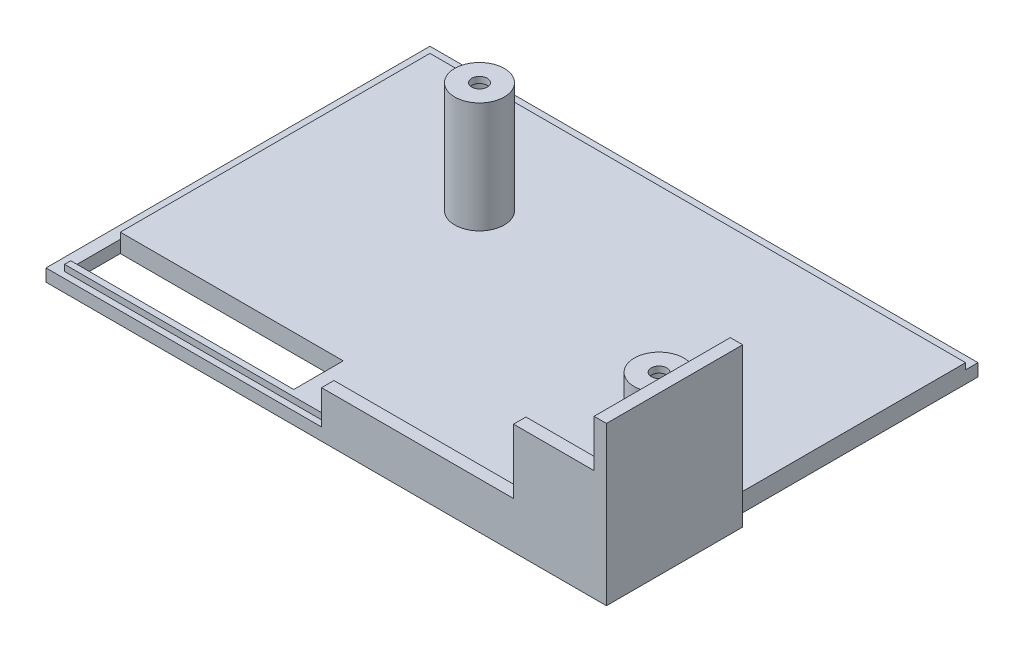
from build123d import *

# Parameters (mm, degrees)
SKETCH1_W           = 90.5
SKETCH1_H           = 62
BOSS_EXTRUDE2_DEPTH = 2
SKETCH5_W           = 88.5
SKETCH5_H           = 59
BOSS_EXTRUDE4_DEPTH = 1
SKETCH6_W           = 46
SKETCH6_H           = 2
BOSS_EXTRUDE5_DEPTH = 5.5
SKETCH7_W           = 15
SKETCH7_H           = 2
BOSS_EXTRUDE6_DEPTH = 10.4
SKETCH8_W           = 2
SKETCH8_H           = 22
BOSS_EXTRUDE7_DEPTH = 22.5
SKETCH9_W           = 36
SKETCH9_H           = 8
CUT_EXTRUDE3_DEPTH  = 15.9
SKETCH10_R          = 4
BOSS_EXTRUDE9_DEPTH = 17.9
SKETCH14_R          = 3
CUT_EXTRUDE7_DEPTH  = 19.9
SKETCH15_R          = 1.25
CUT_EXTRUDE8_DEPTH  = 113.625485571
SKETCH17_W          = 2
SKETCH17_H          = 40
CUT_EXTRUDE9_DEPTH  = 112.98437391


with BuildPart() as part:
    # Sketch1 → Boss-Extrude2 (new body)
    with BuildSketch(Plane(origin=(0, 0, 0), x_dir=(1, 0, 0), z_dir=(0, 1, 0))):
        with Locations((45.25, 31)):
            Rectangle(SKETCH1_W, SKETCH1_H)
    extrude(amount=BOSS_EXTRUDE2_DEPTH)

    # Sketch5 → Boss-Extrude4 (add)
    with BuildSketch(Plane(origin=(0, 2, 0), x_dir=(1, 0, 0), z_dir=(0, 1, 0))):
        with Locations((46.25, 30.5)):
            Rectangle(SKETCH5_W, SKETCH5_H)
    extrude(amount=BOSS_EXTRUDE4_DEPTH)

    # Sketch6 → Boss-Extrude5 (add)
    with BuildSketch(Plane(origin=(0, 2, 0), x_dir=(1, 0, 0), z_dir=(0, 1, 0))):
        with Locations((67.5, 1)):
            Rectangle(SKETCH6_W, SKETCH6_H)
    extrude(amount=BOSS_EXTRUDE5_DEPTH)

    # Sketch7 → Boss-Extrude6 (add)
    with BuildSketch(Plane(origin=(0, 7.5, 0), x_dir=(1, 0, 0), z_dir=(0, 1, 0))):
        with Locations((83, 1)):
            Rectangle(SKETCH7_W, SKETCH7_H)
    extrude(amount=BOSS_EXTRUDE6_DEPTH)

    # Sketch8 → Boss-Extrude7 (add)
    with BuildSketch(Plane(origin=(0, 3, 0), x_dir=(1, 0, 0), z_dir=(0, 1, 0))):
        with Locations((89.5, 11)):
            Rectangle(SKETCH8_W, SKETCH8_H)
    extrude(amount=BOSS_EXTRUDE7_DEPTH)

    # Sketch9 → Cut-Extrude3 (cut)
    with BuildSketch(Plane(origin=(0, 3, 0), x_dir=(1, 0, 0), z_dir=(0, 1, 0))):
        with Locations((20, 6)):
            Rectangle(SKETCH9_W, SKETCH9_H)
    extrude(amount=-CUT_EXTRUDE3_DEPTH, mode=Mode.SUBTRACT)

    # Sketch10 → Boss-Extrude9 (add)
    with BuildSketch(Plane(origin=(0, 3, 0), x_dir=(1, 0, 0), z_dir=(0, 1, 0))):
        with Locations(Location((28, 42, 0), (0, 0, 90))):
            Circle(SKETCH10_R)
        with Locations(Location((83, 16, 0), (0, 0, 90))):
            Circle(SKETCH10_R)
    extrude(amount=BOSS_EXTRUDE9_DEPTH)

    # Sketch14 → Cut-Extrude7 (cut)
    with BuildSketch(Plane.XZ):
        with Locations(Location((28, -42, 0), (0, 0, 270))):
            Circle(SKETCH14_R)
        with Locations(Location((83, -16, 0), (0, 0, 270))):
            Circle(SKETCH14_R)
    extrude(amount=-CUT_EXTRUDE7_DEPTH, mode=Mode.SUBTRACT)

    # Sketch15 → Cut-Extrude8 (cut, through all)
    with BuildSketch(Plane.XZ):
        with Locations(Location((28, -42, 0), (0, 0, 270))):
            Circle(SKETCH15_R)
        with Locations(Location((83, -16, 0), (0, 0, 270))):
            Circle(SKETCH15_R)
    extrude(amount=-CUT_EXTRUDE8_DEPTH, mode=Mode.SUBTRACT)

    # Sketch17 → Cut-Extrude9 (cut, through all)
    with BuildSketch(Plane(origin=(0, 3, 0), x_dir=(1, 0, 0), z_dir=(0, 1, 0))):
        with Locations((89.5, 42)):
            Rectangle(SKETCH17_W, SKETCH17_H)
    extrude(amount=-CUT_EXTRUDE9_DEPTH, mode=Mode.SUBTRACT)


solid = part.part
